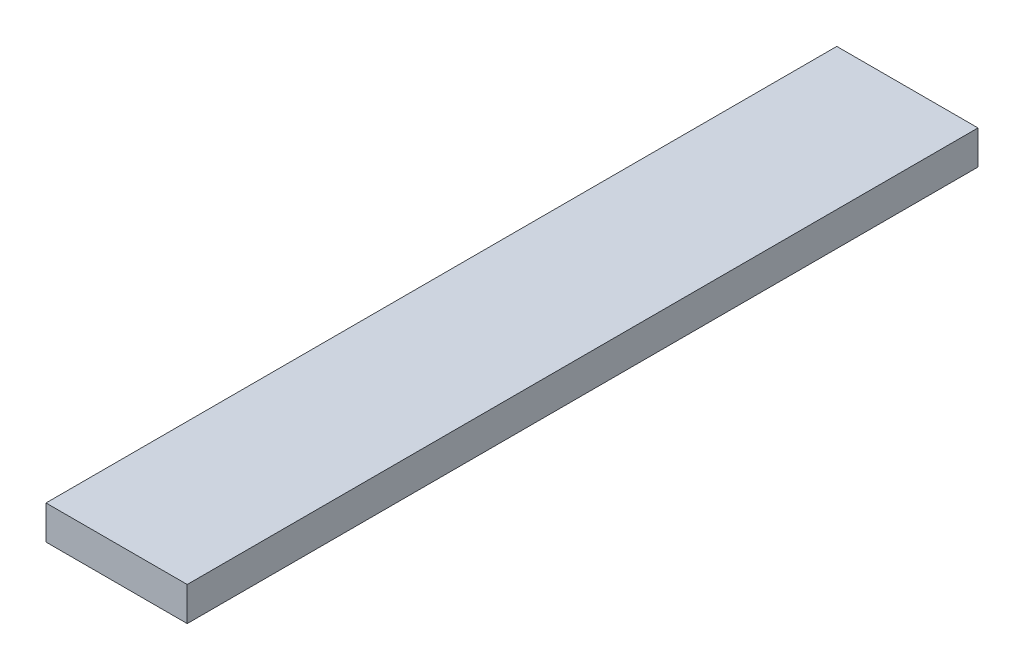
from build123d import *

# Parameters (mm, degrees)
CROQUIS1_W              = 25
CROQUIS1_H              = 6
SALIENTE_EXTRUIR1_DEPTH = 140


with BuildPart() as part:
    # Croquis1 → Saliente-Extruir1 (new body)
    with BuildSketch(Plane.XY):
        Rectangle(CROQUIS1_W, CROQUIS1_H)
    extrude(amount=SALIENTE_EXTRUIR1_DEPTH)


solid = part.part
